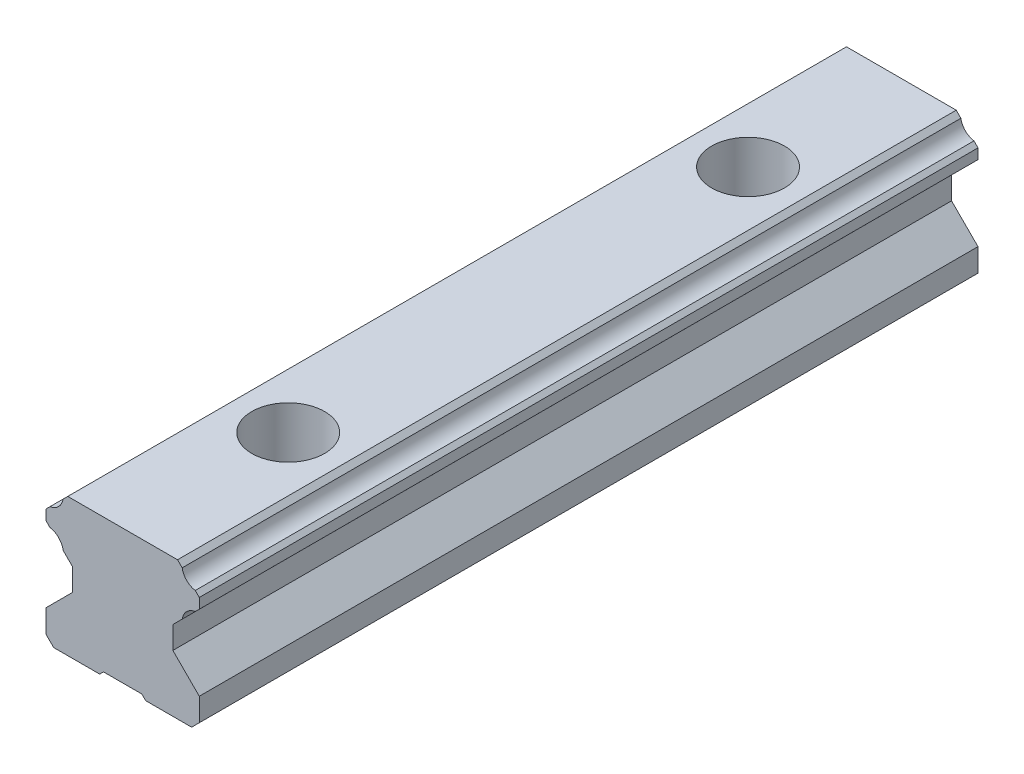
from build123d import *

# Parameters (mm, degrees)
EXTRUDE1_DEPTH     = 220
LPATTERN1_COUNT    = 4
LPATTERN1_PITCH    = 60
SKETCH3_R          = 82.349198064
CUT_EXTRUDE1_DEPTH = 118.39956


with BuildPart() as part:
    # Sketch1 → Extrude1 (new body)
    with BuildSketch(Plane(origin=(-20, 0, 0), x_dir=(1, 0, 0), z_dir=(0, 0, 1))):
        with BuildLine():
            Line((10, 4.000077248), (10, 1))
            Line((10, 1), (11, 0))
            Line((11, 0), (17, 0))
            Line((17, 0), (17.5, 0.5))
            Line((17.5, 0.5), (22.5, 0.5))
            Line((22.5, 0.5), (23, 0))
            Line((23, 0), (29, 0))
            Line((29, 0), (30, 1))
            Line((30, 1), (30, 4.000077248))
            Line((30, 4.000077248), (26.550048828, 7.449951172))
            Line((26.550048828, 7.449951172), (26.550048828, 10.379235268))
            Line((26.550048828, 10.379235268), (27.767930373, 11.595131504))
            ThreePointArc((27.767930373, 11.595131504), (28.341068744, 12.731631743), (29.472673258, 13.314376637))
            Line((29.472673258, 13.314376637), (30, 13.82918644))
            Line((30, 13.82918644), (30, 15.160037041))
            Line((30, 15.160037041), (29.472673258, 15.687363783))
            ThreePointArc((29.472673258, 15.687363783), (28.344874488, 16.264307267), (27.767930373, 17.392105714))
            Line((27.767930373, 17.392105714), (27.160036564, 18))
            Line((27.160036564, 18), (12.839963436, 18))
            Line((12.839963436, 18), (12.232069627, 17.392105714))
            ThreePointArc((12.232069627, 17.392105714), (11.655125512, 16.264307267), (10.527326742, 15.687363783))
            Line((10.527326742, 15.687363783), (10, 15.160037041))
            Line((10, 15.160037041), (10, 13.82918644))
            Line((10, 13.82918644), (10.527326742, 13.314376637))
            ThreePointArc((10.527326742, 13.314376637), (11.658931256, 12.731631743), (12.232069627, 11.595131504))
            Line((12.232069627, 11.595131504), (13.449951172, 10.379235268))
            Line((13.449951172, 10.379235268), (13.449951172, 7.449951172))
            Line((13.449951172, 7.449951172), (10, 4.000077248))
        make_face()
    extrude(amount=-EXTRUDE1_DEPTH)

    # Sketch2 → Cut-Revolve1 (revolve, cut)
    with BuildSketch(Plane(origin=(0, 0, 0), x_dir=(0, 0, -1), z_dir=(1, 0, 0))):
        Polygon((20, 18), (24.75, 18), (24.75, 9.5), (23, 9.5), (23, 0), (20, 0), align=None)
    cut_revolve1 = revolve(axis=Axis((0, 0, -20), (0, 1, 0)), mode=Mode.SUBTRACT)

    # LPattern1: Cut-Revolve1 ×4
    with Locations(*[(0, 0, -i * LPATTERN1_PITCH) for i in range(1, LPATTERN1_COUNT)]):
        add(cut_revolve1, mode=Mode.SUBTRACT)

    # Sketch3 → Cut-Extrude1 (cut)
    with BuildSketch(Plane(origin=(7.767930373, 17.392105714, 0), x_dir=(1, 0, 0), z_dir=(0, 0, 1))):
        with Locations((-44.089026553, 19.698119616)):
            Circle(SKETCH3_R)
    extrude(amount=-CUT_EXTRUDE1_DEPTH, mode=Mode.SUBTRACT)


solid = part.part
